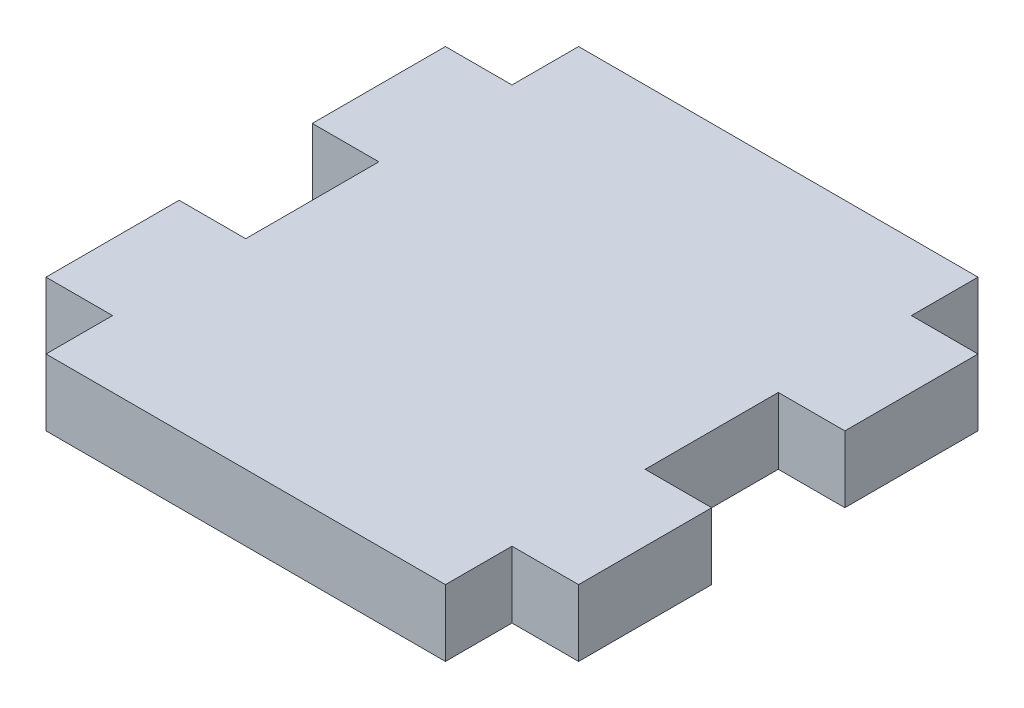
from build123d import *

# Parameters (mm, degrees)
EXTRUDE_1_DEPTH = 5


with BuildPart() as part:
    # 草图1 → 凸台-拉伸1 (new body)
    with BuildSketch(Plane(origin=(0, 0, 0), x_dir=(1, 0, 0), z_dir=(0, 1, 0))):
        Polygon((0, 0), (30, 0), (30, 5), (35, 5), (35, 15), (30, 15), (30, 25), (35, 25), (35, 35), (30, 35), (30, 40), (0, 40), (0, 35), (-5, 35), (-5, 25), (0, 25), (0, 15), (-5, 15), (-5, 5), (0, 5), align=None)
    extrude(amount=EXTRUDE_1_DEPTH)


solid = part.part
